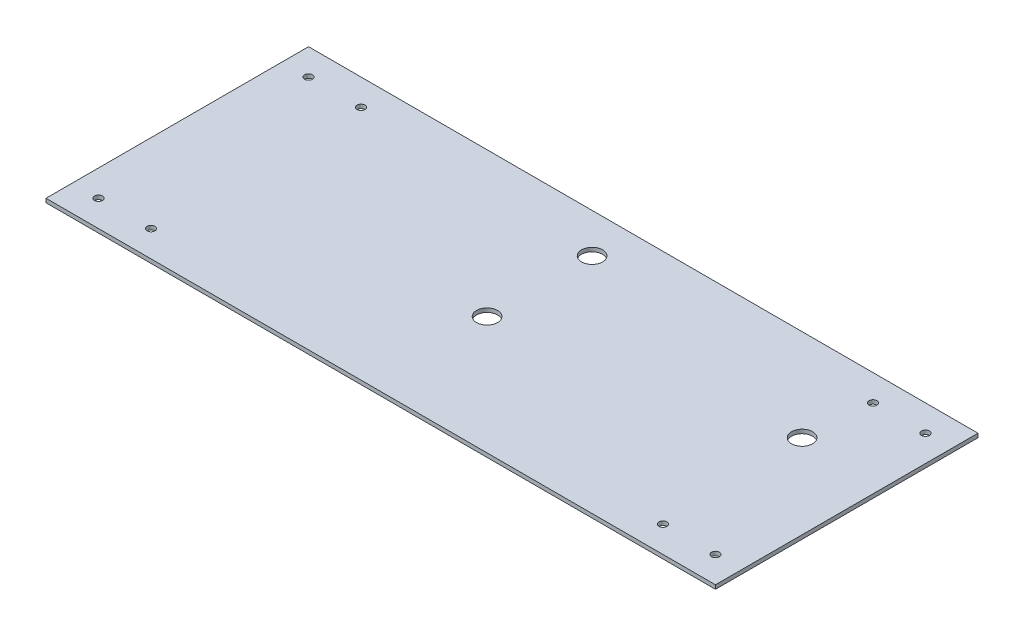
from build123d import *

# Parameters (mm, degrees)
SKETCH1_W           = 255
SKETCH1_H           = 100
BOSS_EXTRUDE1_DEPTH = 1.5
SKETCH2_R           = 1.5
CUT_EXTRUDE2_DEPTH  = 10
SKETCH4_R           = 4
CUT_EXTRUDE3_DEPTH  = 137.961673471


with BuildPart() as part:
    # Sketch1 → Boss-Extrude1 (new body)
    with BuildSketch(Plane(origin=(0, 0, 0), x_dir=(1, 0, 0), z_dir=(0, 1, 0))):
        Rectangle(SKETCH1_W, SKETCH1_H)
    extrude(amount=BOSS_EXTRUDE1_DEPTH)

    # Sketch2 → Cut-Extrude2 (cut)
    with BuildSketch(Plane(origin=(0, 1.5, 0), x_dir=(1, 0, 0), z_dir=(0, 1, 0))):
        with Locations(Location((117.5, 40, 0), (0, 0, 270))):
            Circle(SKETCH2_R)
        with Locations(Location((97.5, 40, 0), (0, 0, 270))):
            Circle(SKETCH2_R)
        with Locations(Location((97.5, -40, 0), (0, 0, 270))):
            Circle(SKETCH2_R)
        with Locations(Location((117.5, -40, 0), (0, 0, 270))):
            Circle(SKETCH2_R)
        with Locations(Location((-97.5, 40, 0), (0, 0, 270))):
            Circle(SKETCH2_R)
        with Locations(Location((-117.5, 40, 0), (0, 0, 270))):
            Circle(SKETCH2_R)
        with Locations(Location((-117.5, -40, 0), (0, 0, 270))):
            Circle(SKETCH2_R)
        with Locations(Location((-97.5, -40, 0), (0, 0, 270))):
            Circle(SKETCH2_R)
    extrude(amount=-CUT_EXTRUDE2_DEPTH, mode=Mode.SUBTRACT)

    # Sketch4 → Cut-Extrude3 (cut, through all)
    with BuildSketch(Plane(origin=(0, 1.5, 0), x_dir=(1, 0, 0), z_dir=(0, 1, 0))):
        with Locations(Location((95.5, 15, 0), (0, 0, 270))):
            Circle(SKETCH4_R)
        with Locations(Location((-4.5, 35, 0), (0, 0, 270))):
            Circle(SKETCH4_R)
        with Locations(Location((-4.5, -5, 0), (0, 0, 270))):
            Circle(SKETCH4_R)
    extrude(amount=-CUT_EXTRUDE3_DEPTH, mode=Mode.SUBTRACT)


solid = part.part
